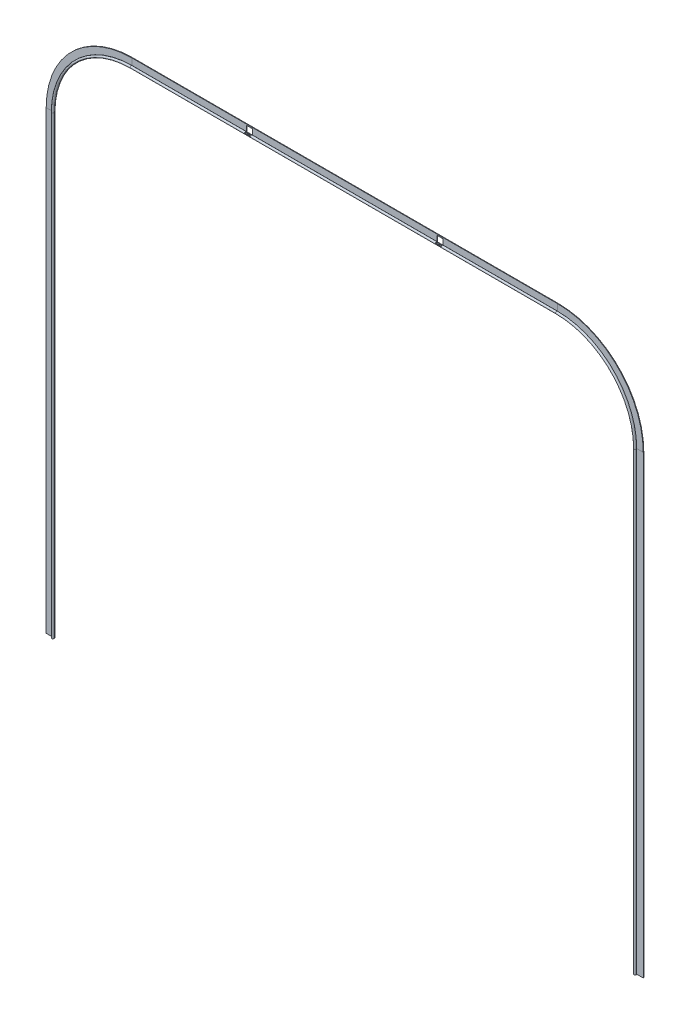
from build123d import *

# Parameters (mm, degrees)
SKETCH2_R          = 2
SKETCH3_W          = 22
SKETCH3_H          = 22
CUT_EXTRUDE1_DEPTH = 2934.581386125


with BuildPart() as part:
    # Sweep1: sweep along a path in Sketch1
    with BuildLine(Plane.XY) as sweep1_path:
        Line((0, 0), (0, 1670))
        ThreePointArc((0, 1670), (83.474567362, 1871.525432638), (285, 1955))
        Line((285, 1955), (1845, 1955))
        ThreePointArc((1845, 1955), (2046.525432638, 1871.525432638), (2130, 1670))
        Line((2130, 1670), (2130, 0))
    # Sketch2 → Sweep1 (sweep)
    with BuildSketch(Plane(origin=(0, 0, 0), x_dir=(1, 0, 0), z_dir=(0, 1, 0))):
        with BuildLine():
            Line((0, 0), (0, -2))
            ThreePointArc((0, -2), (-3, -8.645751311), (-6, -2))
            Line((-6, -2), (-30, -2))
            Line((-30, -2), (-30, 0))
            Line((-30, 0), (0, 0))
        make_face()
        with Locations((-3, -4.645751311)):
            Circle(SKETCH2_R, mode=Mode.SUBTRACT)
    sweep(path=sweep1_path.line)

    # Sketch3 → Cut-Extrude1 (cut, through all)
    with BuildSketch(Plane(origin=(0, 0, 0), x_dir=(-1, 0, 0), z_dir=(0, 0, -1))):
        with Locations((-1415, 1970)):
            Rectangle(SKETCH3_W, SKETCH3_H)
        with Locations((-715, 1970)):
            Rectangle(SKETCH3_W, SKETCH3_H)
    extrude(amount=-CUT_EXTRUDE1_DEPTH, mode=Mode.SUBTRACT)


solid = part.part
